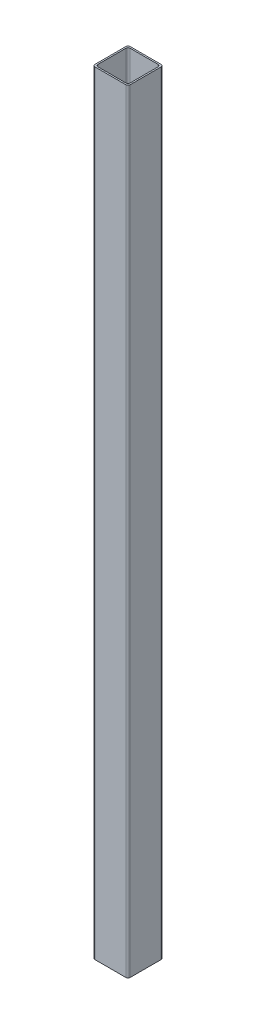
from build123d import *

# Parameters (mm, degrees)
BOSS_EXTRUDE1_DEPTH = 90


with BuildPart() as part:
    # Sketch1 → Boss-Extrude1 (new body)
    with BuildSketch(Plane(origin=(0, 0, 0), x_dir=(1, 0, 0), z_dir=(0, 1, 0))):
        with BuildLine():
            Line((-1.8, -2.05), (1.8, -2.05))
            ThreePointArc((1.8, -2.05), (1.976776695, -1.976776695), (2.05, -1.8))
            Line((2.05, -1.8), (2.05, 1.8))
            ThreePointArc((2.05, 1.8), (1.976776695, 1.976776695), (1.8, 2.05))
            Line((1.8, 2.05), (-1.8, 2.05))
            ThreePointArc((-1.8, 2.05), (-1.976776695, 1.976776695), (-2.05, 1.8))
            Line((-2.05, 1.8), (-2.05, -1.8))
            ThreePointArc((-2.05, -1.8), (-1.976776695, -1.976776695), (-1.8, -2.05))
        make_face()
        with BuildLine():
            Line((-1.625, -1.875), (1.625, -1.875))
            ThreePointArc((1.625, -1.875), (1.801776695, -1.801776695), (1.875, -1.625))
            Line((1.875, -1.625), (1.875, 1.625))
            ThreePointArc((1.875, 1.625), (1.801776695, 1.801776695), (1.625, 1.875))
            Line((1.625, 1.875), (-1.625, 1.875))
            ThreePointArc((-1.625, 1.875), (-1.801776695, 1.801776695), (-1.875, 1.625))
            Line((-1.875, 1.625), (-1.875, -1.625))
            ThreePointArc((-1.875, -1.625), (-1.801776695, -1.801776695), (-1.625, -1.875))
        make_face(mode=Mode.SUBTRACT)
    extrude(amount=BOSS_EXTRUDE1_DEPTH)


solid = part.part
